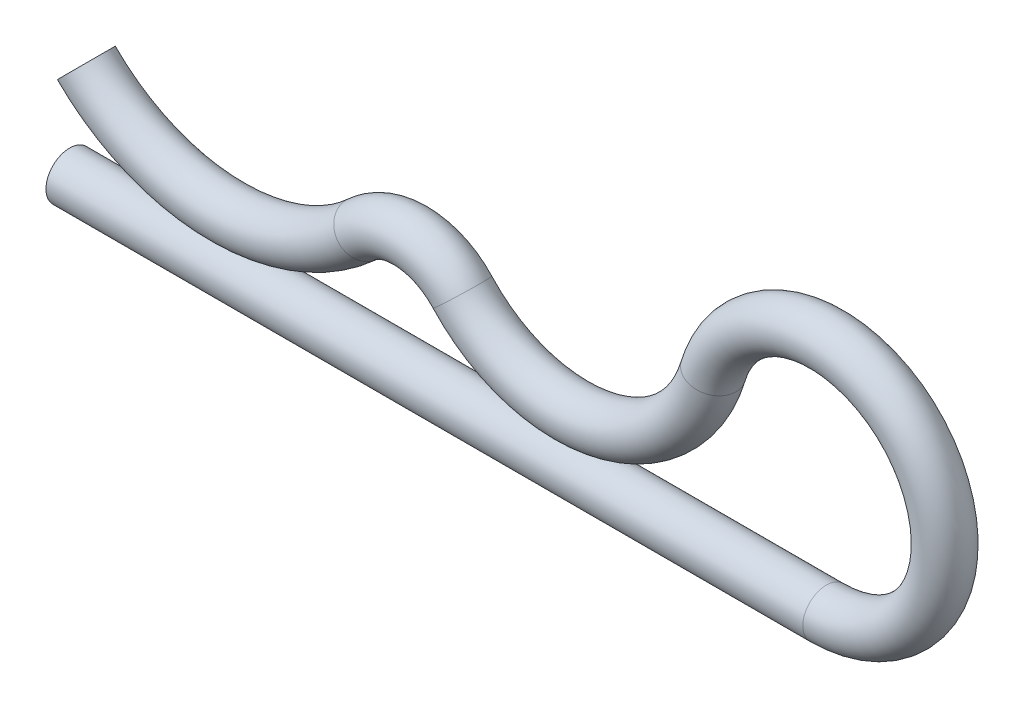
from build123d import *

# Parameters (mm, degrees)
SKETCH2_R = 0.396875


with BuildPart() as part:
    # Sweep1: sweep along a path in Sketch1
    with BuildLine(Plane.XY) as sweep1_path:
        Line((0, 0), (12.7, 0))
        ThreePointArc((12.7, 0), (14.293351819, 3.167157365), (10.800572289, 2.558760334))
        ThreePointArc((10.800572289, 2.558760334), (8.97545423, 0.855988324), (6.592385399, 1.598599522))
        ThreePointArc((6.592385399, 1.598599522), (5.767080402, 1.983235402), (4.911316299, 1.672203414))
        ThreePointArc((4.911316299, 1.672203414), (2.575336852, 0.794576323), (0.280633004, 1.775067802))
    # Sketch2 → Sweep1 (sweep)
    with BuildSketch(Plane(origin=(0, 0, 0), x_dir=(0, 0, -1), z_dir=(1, 0, 0))):
        Circle(SKETCH2_R)
    sweep(path=sweep1_path.line)


solid = part.part
